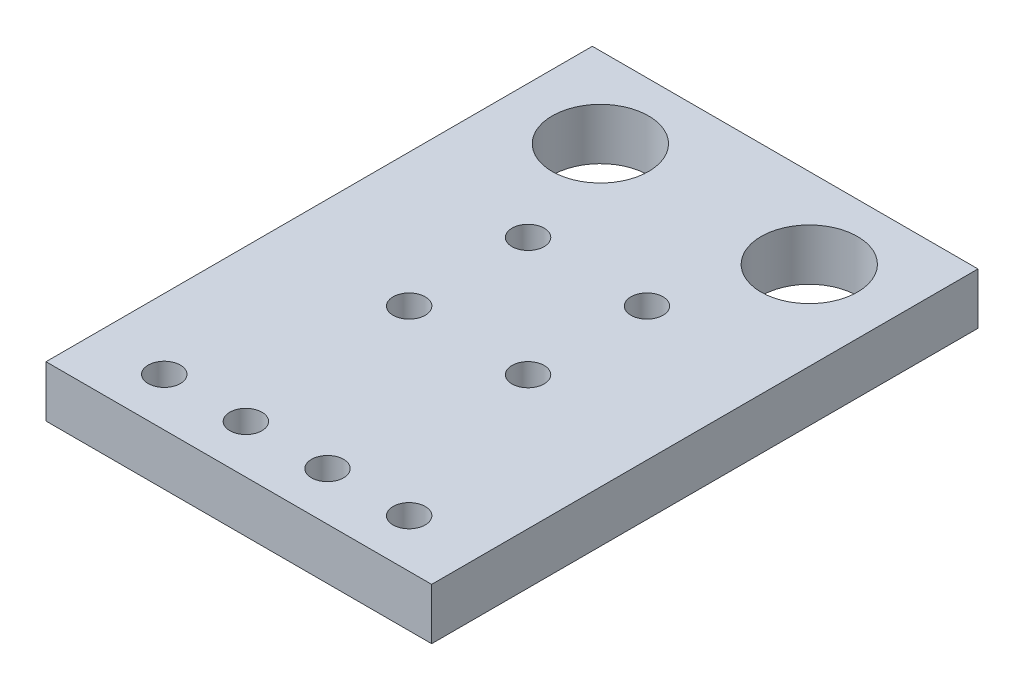
from build123d import *

# Parameters (mm, degrees)
SKETCH_2_W      = 12
SKETCH_2_H      = 17
SKETCH_2_R      = 1.5
SKETCH_2_R_2    = 0.5
EXTRUDE_1_DEPTH = 1.6


with BuildPart() as part:
    # Эскиз2 → Бобышка-Вытянуть1 (new body)
    with BuildSketch(Plane(origin=(0, 0, 0), x_dir=(1, 0, 0), z_dir=(0, 1, 0))):
        with Locations((0, -8.5)):
            Rectangle(SKETCH_2_W, SKETCH_2_H)
        with Locations(Location((-3.25, -2.5, 0), (0, 0, 270))):
            Circle(SKETCH_2_R, mode=Mode.SUBTRACT)
        with Locations(Location((3.25, -2.5, 0), (0, 0, 270))):
            Circle(SKETCH_2_R, mode=Mode.SUBTRACT)
        with Locations(Location((-3.82, -15.5, 0), (0, 0, 270))):
            Circle(SKETCH_2_R_2, mode=Mode.SUBTRACT)
        with Locations(Location((-1.28, -15.5, 0), (0, 0, 270))):
            Circle(SKETCH_2_R_2, mode=Mode.SUBTRACT)
        with Locations(Location((1.26, -15.5, 0), (0, 0, 270))):
            Circle(SKETCH_2_R_2, mode=Mode.SUBTRACT)
        with Locations(Location((3.8, -15.5, 0), (0, 0, 270))):
            Circle(SKETCH_2_R_2, mode=Mode.SUBTRACT)
        with Locations(Location((-1.85, -6.15, 0), (0, 0, 270))):
            Circle(SKETCH_2_R_2, mode=Mode.SUBTRACT)
        with Locations(Location((-1.85, -9.85, 0), (0, 0, 270))):
            Circle(SKETCH_2_R_2, mode=Mode.SUBTRACT)
        with Locations(Location((1.85, -9.85, 0), (0, 0, 270))):
            Circle(SKETCH_2_R_2, mode=Mode.SUBTRACT)
        with Locations(Location((1.85, -6.15, 0), (0, 0, 270))):
            Circle(SKETCH_2_R_2, mode=Mode.SUBTRACT)
    extrude(amount=EXTRUDE_1_DEPTH)


solid = part.part
